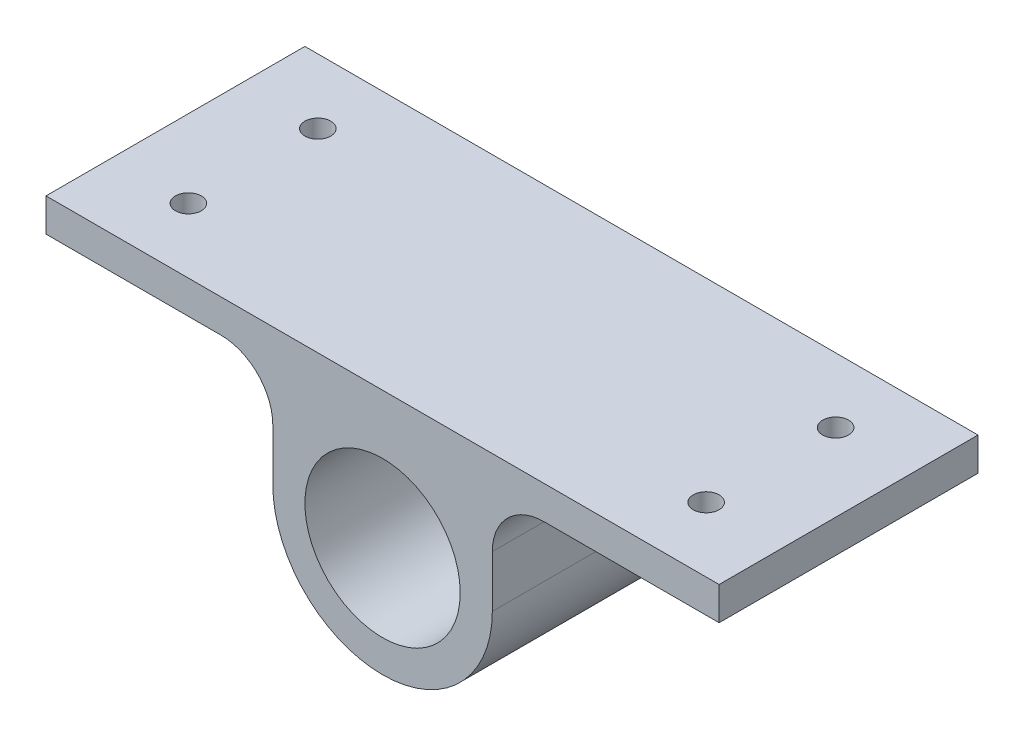
from build123d import *

# Parameters (mm, degrees)
SKETCH1_R           = 75
BOSS_EXTRUDE1_DEPTH = 250
SKETCH2_R           = 12.5
CUT_EXTRUDE1_DEPTH  = 250


with BuildPart() as part:
    # Sketch1 → Boss-Extrude1 (new body)
    with BuildSketch(Plane.XY):
        with BuildLine():
            Line((-106, 0), (-106, 50))
            ThreePointArc((-106, 50), (-120.644660941, 85.355339059), (-156, 100))
            Line((-156, 100), (-325, 100))
            Line((-325, 100), (-325, 132))
            Line((-325, 132), (325, 132))
            Line((325, 132), (325, 100))
            Line((325, 100), (156, 100))
            ThreePointArc((156, 100), (120.644660941, 85.355339059), (106, 50))
            Line((106, 50), (106, 0))
            ThreePointArc((106, 0), (0, -106), (-106, 0))
        make_face()
        Circle(SKETCH1_R, mode=Mode.SUBTRACT)
    extrude(amount=BOSS_EXTRUDE1_DEPTH)

    # Sketch2 → Cut-Extrude1 (cut)
    with BuildSketch(Plane(origin=(0, 132, 0), x_dir=(1, 0, 0), z_dir=(0, 1, 0))):
        with Locations(Location((-250, -62.5, 0), (0, 0, 270))):
            Circle(SKETCH2_R)
        with Locations(Location((-250, -187.5, 0), (0, 0, 270))):
            Circle(SKETCH2_R)
        with Locations(Location((250, -187.5, 0), (0, 0, 270))):
            Circle(SKETCH2_R)
        with Locations(Location((250, -62.5, 0), (0, 0, 270))):
            Circle(SKETCH2_R)
    extrude(amount=-CUT_EXTRUDE1_DEPTH, mode=Mode.SUBTRACT)


solid = part.part
